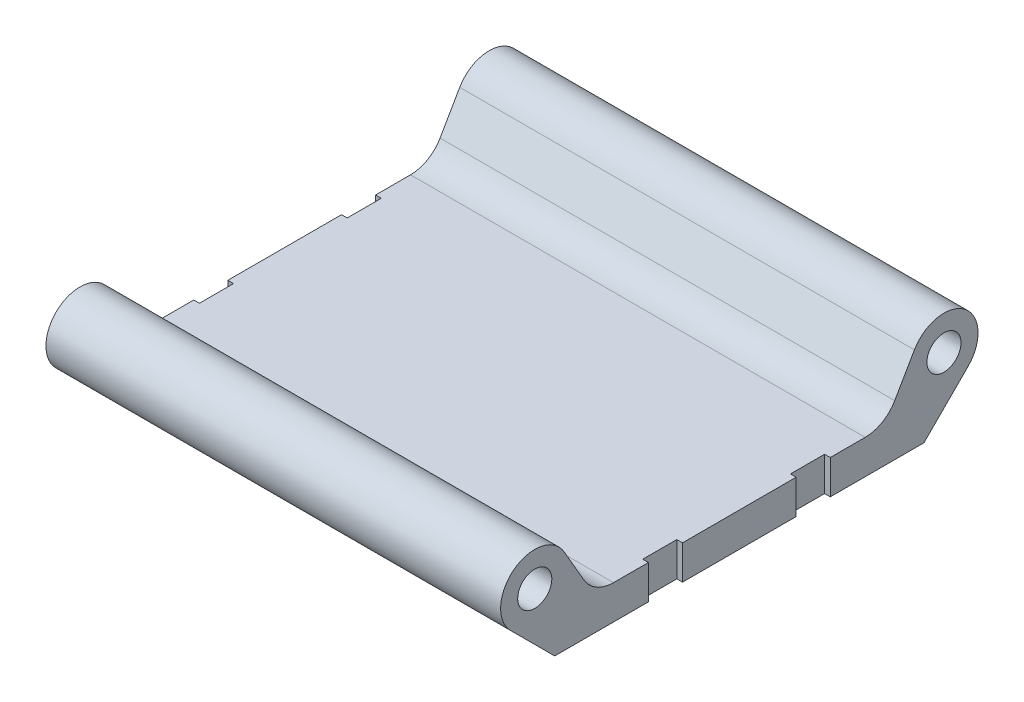
from build123d import *

# Parameters (mm, degrees)
SKETCH_1_R          = 1.5
EXTRUDE_1_DEPTH     = 40
FILLET_1_R          = 3
SKETCH_2_W          = 0.5
SKETCH_2_H          = 3
CUT_EXTRUDE_1_DEPTH = 46.57411546


with BuildPart() as part:
    # 스케치1 → 보스-돌출1 (new body)
    with BuildSketch(Plane(origin=(0, 0, 0), x_dir=(0, 0, -1), z_dir=(1, 0, 0))):
        with BuildLine():
            Line((-15.401923789, 7.5), (-12.803847577, 3))
            Line((-12.803847577, 3), (12.803847577, 3))
            Line((12.803847577, 3), (15.401923789, 7.5))
            ThreePointArc((15.401923789, 7.5), (19.826284287, 8.380060021), (20.121320344, 3.878679656))
            Line((20.121320344, 3.878679656), (16.242640687, 0))
            Line((16.242640687, 0), (0, 0))
            Line((0, 0), (-16.242640687, 0))
            Line((-16.242640687, 0), (-20.121320344, 3.878679656))
            ThreePointArc((-20.121320344, 3.878679656), (-19.826284287, 8.380060021), (-15.401923789, 7.5))
        make_face()
        with Locations((18, 6)):
            Circle(SKETCH_1_R, mode=Mode.SUBTRACT)
        with Locations(Location((-18, 6, 0), (0, 0, 180))):
            Circle(SKETCH_1_R, mode=Mode.SUBTRACT)
    extrude(amount=EXTRUDE_1_DEPTH)

    # 필렛1
    fillet_1_edges = [part.edges().sort_by_distance(p)[0] for p in [
        (20, 3, 12.803847577),
        (20, 3, -12.803847577),
    ]]
    fillet(fillet_1_edges, radius=FILLET_1_R)

    # 스케치2 → 컷-돌출1 (cut, through all)
    with BuildSketch(Plane(origin=(0, 3, 0), x_dir=(1, 0, 0), z_dir=(0, 1, 0))):
        with Locations((0.25, 6.5)):
            Rectangle(SKETCH_2_W, SKETCH_2_H)
        with Locations((0.25, -6.5)):
            Rectangle(SKETCH_2_W, SKETCH_2_H)
        with Locations((39.75, 6.5)):
            Rectangle(SKETCH_2_W, SKETCH_2_H)
        with Locations((39.75, -6.5)):
            Rectangle(SKETCH_2_W, SKETCH_2_H)
    extrude(amount=-CUT_EXTRUDE_1_DEPTH, mode=Mode.SUBTRACT)


solid = part.part
